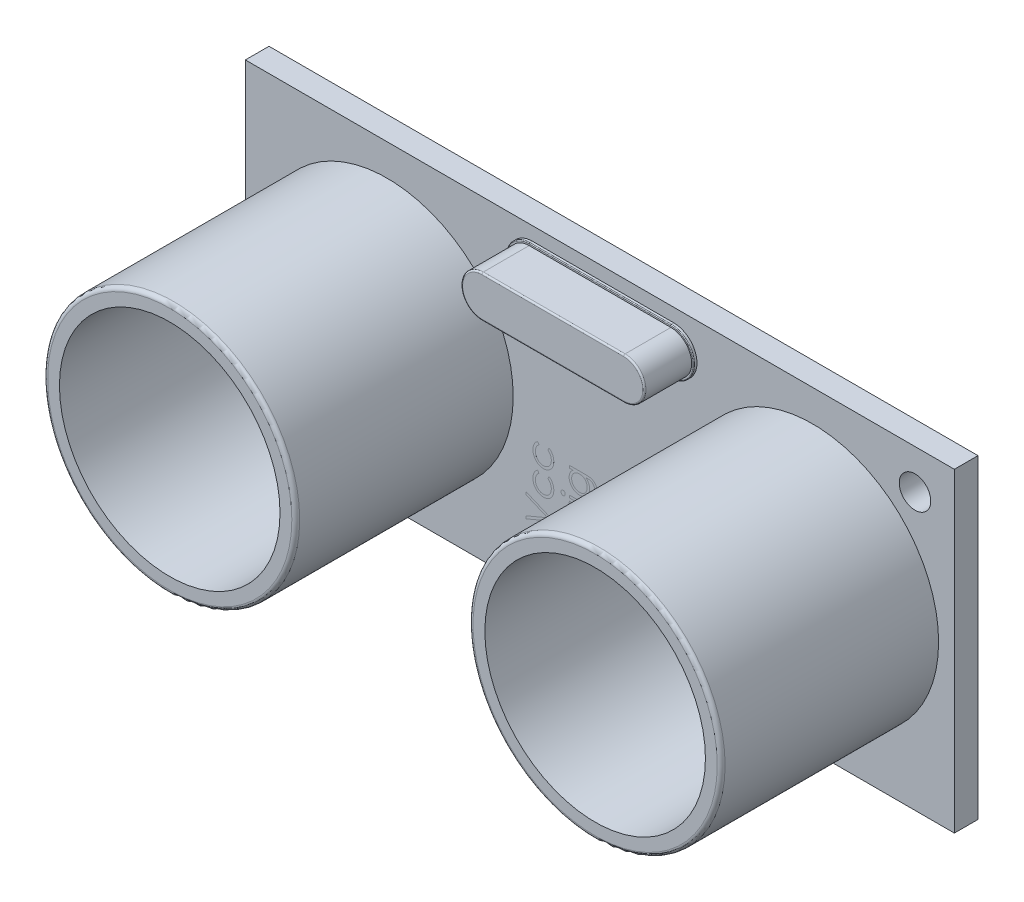
from build123d import *

# Parameters (mm, degrees)
SKETCH1_W                = 45
SKETCH1_H                = 20
SKETCH1_R                = 1
BOSS_EXTRUDE1_DEPTH      = 1.5
SKETCH2_R                = 8
BOSS_EXTRUDE2_DEPTH      = 13.8
SKETCH3_R                = 7
CUT_EXTRUDE1_DEPTH       = 11
SKETCH4_R                = 6
BOSS_EXTRUDE3_DEPTH      = 1
FILLET1_R                = 0.25
BOSS_EXTRUDE4_DEPTH      = 0.2
BOSS_EXTRUDE5_DEPTH      = 3
FILLET2_R                = 0.1
FILLET3_R                = 0.05
BOSS_EXTRUDE6_DEPTH      = 4
BOSS_EXTRUDE6_DEPTH_BACK = 2
SKETCH9_R                = 0.635
SKETCH10_W               = 1.278846153
SKETCH10_H               = 0.157051282
BOSS_EXTRUDE7_DEPTH      = 0.0001


with BuildPart() as part:
    # Sketch1 → Boss-Extrude1 (new body)
    with BuildSketch(Plane.XY):
        with Locations((22.5, 10)):
            Rectangle(SKETCH1_W, SKETCH1_H)
        with Locations((2.5, 2.5)):
            Circle(SKETCH1_R, mode=Mode.SUBTRACT)
        with Locations((42.5, 17.5)):
            Circle(SKETCH1_R, mode=Mode.SUBTRACT)
    extrude(amount=BOSS_EXTRUDE1_DEPTH)

    # Sketch2 → Boss-Extrude2 (add)
    with BuildSketch(Plane.XY.offset(1.5)):
        with Locations(Location((9, 10, 0), (0, 0, 180))):
            Circle(SKETCH2_R)
        with Locations(Location((36, 10, 0), (0, 0, 180))):
            Circle(SKETCH2_R)
    extrude(amount=BOSS_EXTRUDE2_DEPTH)

    # Sketch3 → Cut-Extrude1 (cut)
    with BuildSketch(Plane.XY.offset(15.3)):
        with Locations((9, 10)):
            Circle(SKETCH3_R)
        with Locations((36, 10)):
            Circle(SKETCH3_R)
    extrude(amount=-CUT_EXTRUDE1_DEPTH, mode=Mode.SUBTRACT)

    # Sketch4 → Boss-Extrude3 (add)
    with BuildSketch(Plane.XY.offset(4.3)):
        with Locations((9, 10)):
            Circle(SKETCH4_R)
        with Locations((36, 10)):
            Circle(SKETCH4_R)
    extrude(amount=BOSS_EXTRUDE3_DEPTH)

    # Fillet1
    fillet1_edges = [part.edges().sort_by_distance(p)[0] for p in [
        (17, 10, 15.3),
        (44, 10, 15.3),
    ]]
    fillet(fillet1_edges, radius=FILLET1_R)

    # Sketch6 → Boss-Extrude4 (add)
    with BuildSketch(Plane.XY.offset(1.5)):
        with BuildLine():
            Line((18.212740301, 19.143921077), (27.189190296, 19.143921077))
            ThreePointArc((27.189190296, 19.143921077), (28.662935817, 17.670175555), (27.189190296, 16.196430034))
            Line((27.189190296, 16.196430034), (18.212740301, 16.196430034))
            ThreePointArc((18.212740301, 16.196430034), (16.738994779, 17.670175555), (18.212740301, 19.143921077))
        make_face()
    extrude(amount=BOSS_EXTRUDE4_DEPTH)

    # Sketch7 → Boss-Extrude5 (add)
    with BuildSketch(Plane.XY.offset(1.7)):
        with BuildLine():
            Line((18.210106758, 18.998872551), (27.208079194, 18.998872551))
            ThreePointArc((27.208079194, 18.998872551), (28.527429991, 17.679521754), (27.208079194, 16.360170957))
            Line((27.208079194, 16.360170957), (18.210106758, 16.360170957))
            ThreePointArc((18.210106758, 16.360170957), (16.890755961, 17.679521754), (18.210106758, 18.998872551))
        make_face()
    extrude(amount=BOSS_EXTRUDE5_DEPTH)

    # Fillet2
    fillet2_edges = [part.edges().sort_by_distance(p)[0] for p in [
        (16.890755961, 17.679521754, 4.7),
        (22.709092976, 16.360170957, 4.7),
        (28.527429991, 17.679521754, 4.7),
        (22.709092976, 18.998872551, 4.7),
    ]]
    fillet(fillet2_edges, radius=FILLET2_R)

    # Fillet3
    fillet3_edges = [part.edges().sort_by_distance(p)[0] for p in [
        (16.738994779, 17.670175555, 1.7),
        (22.700965298, 16.196430034, 1.7),
        (28.662935817, 17.670175555, 1.7),
        (22.700965298, 19.143921077, 1.7),
    ]]
    fillet(fillet3_edges, radius=FILLET3_R)

    # Sketch9 → Boss-Extrude6 (add, two sides: drawn at the far end of the back side and taken through both)
    with BuildSketch(Plane(origin=(0, 0, 0), x_dir=(-1, 0, 0), z_dir=(0, 0, -1)).offset(-BOSS_EXTRUDE6_DEPTH_BACK)):
        with Locations((-26.31, 2.5)):
            Circle(SKETCH9_R)
        with Locations((-23.77, 2.5)):
            Circle(SKETCH9_R)
        with Locations((-21.23, 2.5)):
            Circle(SKETCH9_R)
        with Locations((-18.69, 2.5)):
            Circle(SKETCH9_R)
    extrude(amount=BOSS_EXTRUDE6_DEPTH + BOSS_EXTRUDE6_DEPTH_BACK)

    # Sketch10 → Boss-Extrude7 (add)
    # profile 1 of 15: a face of its own
    with BuildSketch(Plane.XY.offset(1.5)):
        Polygon((17.803362212, 3.675659669), (17.803362212, 3.8439289), (19.182468783, 4.427262233), (17.803362212, 5.010595566), (17.803362212, 5.178864797), (19.553362212, 4.438480182), (19.553362212, 4.416044284), align=None)
    # profile 2 of 15: a face of its own
    with BuildSketch(Plane.XY.offset(1.5)):
        with BuildLine():
            Line((18.551809728, 6.72694172), (18.633490417, 6.595481384))
            add(Edge.make_bspline(
                [(18.633490417, 6.595481384), (18.61557622, 6.581066451), (18.580315165, 6.552693103), (18.534810198, 6.503423485), (18.495726678, 6.450917778), (18.463874802, 6.394278754), (18.439264077, 6.333585854), (18.421848974, 6.269078428), (18.410996853, 6.200765676), (18.409763434, 6.153933077), (18.409131443, 6.129936512)],
                knots=[0, 0, 0, 0, 1.026593902, 2.0206758, 2.988051866, 3.946915611, 4.916868779, 5.907761954, 6.927957743, 8, 8, 8, 8], degree=3))
            add(Edge.make_bspline(
                [(18.409131443, 6.129936512), (18.409659864, 6.110757033), (18.410700575, 6.072983572), (18.417205822, 6.017530495), (18.429026826, 5.964709319), (18.444602304, 5.914188964), (18.465477449, 5.866328755), (18.490882327, 5.821003296), (18.520407347, 5.777810551), (18.55461262, 5.73800218), (18.591811954, 5.701587677), (18.631688801, 5.67003822), (18.673048747, 5.642569753), (18.716924618, 5.621016775), (18.762312645, 5.60337919), (18.810069573, 5.591775829), (18.859583576, 5.584043482), (18.893342746, 5.583158817), (18.910433526, 5.582710951)],
                knots=[0, 0, 0, 0, 1.112346261, 2.190735716, 3.231507886, 4.247384806, 5.251966152, 6.253067467, 7.256802811, 8.280671706, 9.291813951, 10.270744147, 11.225547591, 12.165006084, 13.100104208, 14.043489273, 15.009504848, 16, 16, 16, 16], degree=3))
            add(Edge.make_bspline(
                [(18.910433526, 5.582710951), (18.932814933, 5.58361406), (18.977390707, 5.585412731), (19.043078589, 5.599093018), (19.106470777, 5.621983742), (19.16722456, 5.652908049), (19.223516747, 5.692161356), (19.274009771, 5.738243731), (19.317717438, 5.791204317), (19.353953796, 5.850570195), (19.383084454, 5.914949146), (19.403838127, 5.983644176), (19.416364312, 6.056094073), (19.417942284, 6.105697445), (19.418746827, 6.130988194)],
                knots=[0, 0, 0, 0, 0.96628757, 1.924499989, 2.884001032, 3.87047137, 4.860396324, 5.839257425, 6.814467993, 7.816059692, 8.834901047, 9.858382822, 10.908076205, 12, 12, 12, 12], degree=3))
            add(Edge.make_bspline(
                [(19.418746827, 6.130988194), (19.418097079, 6.154165787), (19.41682015, 6.199715906), (19.406055669, 6.266299548), (19.388433852, 6.329689504), (19.363860027, 6.389883519), (19.332096269, 6.446771602), (19.292916684, 6.49998619), (19.247448383, 6.550586159), (19.212289398, 6.580334647), (19.194387853, 6.595481384)],
                knots=[0, 0, 0, 0, 1.039848629, 2.043578496, 3.018386758, 3.987534228, 4.954977003, 5.934852016, 6.948509513, 8, 8, 8, 8], degree=3))
            Line((19.194387853, 6.595481384), (19.280625834, 6.72694172))
            add(Edge.make_bspline(
                [(19.280625834, 6.72694172), (19.292071197, 6.719147869), (19.314923936, 6.703586036), (19.347145994, 6.677572223), (19.377306835, 6.649512307), (19.40536603, 6.619515759), (19.43199504, 6.587974254), (19.455920827, 6.553810299), (19.478488238, 6.518125493), (19.498794674, 6.480500914), (19.517047835, 6.441325565), (19.532743421, 6.40065457), (19.546228474, 6.358664664), (19.556947147, 6.315306476), (19.565502566, 6.270494527), (19.571179417, 6.22434471), (19.575417058, 6.176872919), (19.575669991, 6.144786843), (19.575798109, 6.128534268)],
                knots=[0, 0, 0, 0, 0.954134338, 1.905101784, 2.851144739, 3.791306361, 4.734911809, 5.6936923, 6.663572882, 7.643865596, 8.638447847, 9.640600242, 10.646758161, 11.676244097, 12.717260333, 13.78922464, 14.880174919, 16, 16, 16, 16], degree=3))
            add(Edge.make_bspline(
                [(19.575798109, 6.128534268), (19.575351729, 6.103729151), (19.574476821, 6.055110941), (19.564883028, 5.983945109), (19.55036629, 5.9159549), (19.529707539, 5.851020833), (19.502425286, 5.789539888), (19.469862946, 5.731000236), (19.430944426, 5.676005965), (19.386594301, 5.624917602), (19.338459422, 5.578197311), (19.286817925, 5.53754331), (19.232810939, 5.503090314), (19.176098043, 5.474709062), (19.116911787, 5.452517571), (19.054890598, 5.43723952), (18.990560693, 5.427381602), (18.946694771, 5.426238958), (18.924455962, 5.425659669)],
                knots=[0, 0, 0, 0, 1.113096611, 2.181677437, 3.217994567, 4.231807234, 5.234933164, 6.233258928, 7.234764453, 8.254006763, 9.267004511, 10.242118657, 11.199842941, 12.138404996, 13.084707599, 14.031460992, 15.002005182, 16, 16, 16, 16], degree=3))
            add(Edge.make_bspline(
                [(18.924455962, 5.425659669), (18.909366745, 5.425880177), (18.879351801, 5.426318804), (18.834804268, 5.431349768), (18.790849995, 5.437849004), (18.748046135, 5.448861873), (18.70574349, 5.461582189), (18.66445194, 5.477819954), (18.623979603, 5.496867652), (18.584430739, 5.518493626), (18.546455969, 5.542837998), (18.510579136, 5.569778615), (18.476369254, 5.598300783), (18.445007373, 5.629738839), (18.415239278, 5.662758666), (18.387860216, 5.698294454), (18.36278972, 5.736142379), (18.339564212, 5.775734041), (18.318884495, 5.817046396), (18.301067876, 5.859829732), (18.285841588, 5.903826246), (18.273787128, 5.949106318), (18.263678417, 5.995369405), (18.257319493, 6.042980074), (18.252826357, 6.091756185), (18.252330961, 6.124784196), (18.252080161, 6.141505021)],
                knots=[0, 0, 0, 0, 0.990994727, 1.971252077, 2.943264845, 3.907940874, 4.872158414, 5.844625996, 6.82015047, 7.809835459, 8.804511986, 9.781214284, 10.756496977, 11.728388426, 12.696359165, 13.676225489, 14.672885716, 15.677705647, 16.690706858, 17.706033469, 18.721040654, 19.747369689, 20.783475414, 21.830280724, 22.901553713, 24, 24, 24, 24], degree=3))
            add(Edge.make_bspline(
                [(18.252080161, 6.141505021), (18.252541059, 6.162445101), (18.25346055, 6.204220593), (18.261200585, 6.26619056), (18.272866128, 6.327249611), (18.290162436, 6.386317767), (18.311058705, 6.442710418), (18.334665582, 6.495358192), (18.361498287, 6.543466003), (18.391392543, 6.587458188), (18.425446871, 6.627322558), (18.463314643, 6.66408085), (18.505268431, 6.697975248), (18.536167928, 6.717206543), (18.551809728, 6.72694172)],
                knots=[0, 0, 0, 0, 1.095139042, 2.184804066, 3.262657822, 4.34424993, 5.400369085, 6.407210964, 7.359649996, 8.278719237, 9.185177137, 10.097389079, 11.036869154, 12, 12, 12, 12], degree=3))
        make_face()
    # profile 3 of 15: a face of its own
    with BuildSketch(Plane.XY.offset(1.5)):
        with BuildLine():
            Line((18.551809728, 8.297454541), (18.633490417, 8.165994204))
            add(Edge.make_bspline(
                [(18.633490417, 8.165994204), (18.61557622, 8.151579271), (18.580315165, 8.123205924), (18.534810198, 8.073936306), (18.495726678, 8.021430599), (18.463874802, 7.964791575), (18.439264077, 7.904098675), (18.421848974, 7.839591249), (18.410996853, 7.771278497), (18.409763434, 7.724445897), (18.409131443, 7.700449332)],
                knots=[0, 0, 0, 0, 1.026593902, 2.0206758, 2.988051866, 3.946915611, 4.916868779, 5.907761954, 6.927957743, 8, 8, 8, 8], degree=3))
            add(Edge.make_bspline(
                [(18.409131443, 7.700449332), (18.409659864, 7.681269854), (18.410700575, 7.643496393), (18.417205822, 7.588043316), (18.429026826, 7.535222139), (18.444602304, 7.484701785), (18.465477449, 7.436841576), (18.490882327, 7.391516116), (18.520407347, 7.348323371), (18.55461262, 7.308515001), (18.591811954, 7.272100497), (18.631688801, 7.24055104), (18.673048747, 7.213082573), (18.716924618, 7.191529595), (18.762312645, 7.17389201), (18.810069573, 7.16228865), (18.859583576, 7.154556302), (18.893342746, 7.153671638), (18.910433526, 7.153223771)],
                knots=[0, 0, 0, 0, 1.112346261, 2.190735716, 3.231507886, 4.247384806, 5.251966152, 6.253067467, 7.256802811, 8.280671706, 9.291813951, 10.270744147, 11.225547591, 12.165006084, 13.100104208, 14.043489273, 15.009504848, 16, 16, 16, 16], degree=3))
            add(Edge.make_bspline(
                [(18.910433526, 7.153223771), (18.932814933, 7.154126881), (18.977390707, 7.155925552), (19.043078589, 7.169605839), (19.106470777, 7.192496563), (19.16722456, 7.22342087), (19.223516747, 7.262674177), (19.274009771, 7.308756551), (19.317717438, 7.361717138), (19.353953796, 7.421083015), (19.383084454, 7.485461966), (19.403838127, 7.554156997), (19.416364312, 7.626606893), (19.417942284, 7.676210266), (19.418746827, 7.701501015)],
                knots=[0, 0, 0, 0, 0.96628757, 1.924499989, 2.884001032, 3.87047137, 4.860396324, 5.839257425, 6.814467993, 7.816059692, 8.834901047, 9.858382822, 10.908076205, 12, 12, 12, 12], degree=3))
            add(Edge.make_bspline(
                [(19.418746827, 7.701501015), (19.418097079, 7.724678607), (19.41682015, 7.770228726), (19.406055669, 7.836812369), (19.388433852, 7.900202324), (19.363860027, 7.96039634), (19.332096269, 8.017284423), (19.292916684, 8.07049901), (19.247448383, 8.121098979), (19.212289398, 8.150847468), (19.194387853, 8.165994204)],
                knots=[0, 0, 0, 0, 1.039848629, 2.043578496, 3.018386758, 3.987534228, 4.954977003, 5.934852016, 6.948509513, 8, 8, 8, 8], degree=3))
            Line((19.194387853, 8.165994204), (19.280625834, 8.297454541))
            add(Edge.make_bspline(
                [(19.280625834, 8.297454541), (19.292071197, 8.28966069), (19.314923936, 8.274098856), (19.347145994, 8.248085043), (19.377306835, 8.220025128), (19.40536603, 8.190028579), (19.43199504, 8.158487074), (19.455920827, 8.124323119), (19.478488238, 8.088638314), (19.498794674, 8.051013735), (19.517047835, 8.011838386), (19.532743421, 7.971167391), (19.546228474, 7.929177485), (19.556947147, 7.885819297), (19.565502566, 7.841007347), (19.571179417, 7.79485753), (19.575417058, 7.747385739), (19.575669991, 7.715299664), (19.575798109, 7.699047089)],
                knots=[0, 0, 0, 0, 0.954134338, 1.905101784, 2.851144739, 3.791306361, 4.734911809, 5.6936923, 6.663572882, 7.643865596, 8.638447847, 9.640600242, 10.646758161, 11.676244097, 12.717260333, 13.78922464, 14.880174919, 16, 16, 16, 16], degree=3))
            add(Edge.make_bspline(
                [(19.575798109, 7.699047089), (19.575351729, 7.674241971), (19.574476821, 7.625623761), (19.564883028, 7.554457929), (19.55036629, 7.486467721), (19.529707539, 7.421533653), (19.502425286, 7.360052708), (19.469862946, 7.301513056), (19.430944426, 7.246518786), (19.386594301, 7.195430423), (19.338459422, 7.148710132), (19.286817925, 7.108056131), (19.232810939, 7.073603135), (19.176098043, 7.045221883), (19.116911787, 7.023030392), (19.054890598, 7.00775234), (18.990560693, 6.997894423), (18.946694771, 6.996751778), (18.924455962, 6.996172489)],
                knots=[0, 0, 0, 0, 1.113096611, 2.181677437, 3.217994567, 4.231807234, 5.234933164, 6.233258928, 7.234764453, 8.254006763, 9.267004511, 10.242118657, 11.199842941, 12.138404996, 13.084707599, 14.031460992, 15.002005182, 16, 16, 16, 16], degree=3))
            add(Edge.make_bspline(
                [(18.924455962, 6.996172489), (18.909366745, 6.996392997), (18.879351801, 6.996831624), (18.834804268, 7.001862588), (18.790849995, 7.008361825), (18.748046135, 7.019374693), (18.70574349, 7.032095009), (18.66445194, 7.048332775), (18.623979603, 7.067380472), (18.584430739, 7.089006446), (18.546455969, 7.113350819), (18.510579136, 7.140291435), (18.476369254, 7.168813603), (18.445007373, 7.200251659), (18.415239278, 7.233271486), (18.387860216, 7.268807274), (18.36278972, 7.3066552), (18.339564212, 7.346246861), (18.318884495, 7.387559217), (18.301067876, 7.430342552), (18.285841588, 7.474339067), (18.273787128, 7.519619139), (18.263678417, 7.565882225), (18.257319493, 7.613492894), (18.252826357, 7.662269006), (18.252330961, 7.695297017), (18.252080161, 7.712017842)],
                knots=[0, 0, 0, 0, 0.990994727, 1.971252077, 2.943264845, 3.907940874, 4.872158414, 5.844625996, 6.82015047, 7.809835459, 8.804511986, 9.781214284, 10.756496977, 11.728388426, 12.696359165, 13.676225489, 14.672885716, 15.677705647, 16.690706858, 17.706033469, 18.721040654, 19.747369689, 20.783475414, 21.830280724, 22.901553713, 24, 24, 24, 24], degree=3))
            add(Edge.make_bspline(
                [(18.252080161, 7.712017842), (18.252541059, 7.732957922), (18.25346055, 7.774733414), (18.261200585, 7.83670338), (18.272866128, 7.897762431), (18.290162436, 7.956830587), (18.311058705, 8.013223238), (18.334665582, 8.065871013), (18.361498287, 8.113978824), (18.391392543, 8.157971009), (18.425446871, 8.197835379), (18.463314643, 8.23459367), (18.505268431, 8.268488068), (18.536167928, 8.287719364), (18.551809728, 8.297454541)],
                knots=[0, 0, 0, 0, 1.095139042, 2.184804066, 3.262657822, 4.34424993, 5.400369085, 6.407210964, 7.359649996, 8.278719237, 9.185177137, 10.097389079, 11.036869154, 12, 12, 12, 12], degree=3))
        make_face()
    # profile 4 of 15: a face of its own
    with BuildSketch(Plane.XY.offset(1.5)):
        with BuildLine():
            Line((20.57270296, 7.84575142), (20.57270296, 8.002802702))
            Line((20.57270296, 8.002802702), (21.587576758, 8.002802702))
            add(Edge.make_bspline(
                [(21.587576758, 8.002802702), (21.609195555, 8.002664181), (21.650925041, 8.002396802), (21.711264181, 8.000471316), (21.766997224, 7.996410977), (21.818378353, 7.991806637), (21.865169408, 7.985183279), (21.907510011, 7.977095095), (21.945440792, 7.967977255), (21.968803212, 7.959967147), (21.979854402, 7.956178103)],
                knots=[0, 0, 0, 0, 1.307562039, 2.523909702, 3.650326591, 4.686913197, 5.643429486, 6.506965704, 7.293745905, 8, 8, 8, 8], degree=3))
            add(Edge.make_bspline(
                [(21.979854402, 7.956178103), (21.994219329, 7.950583457), (22.022519681, 7.93956144), (22.062637325, 7.918919012), (22.100408728, 7.89580062), (22.135634097, 7.869402582), (22.168096727, 7.839812237), (22.198601989, 7.807898565), (22.226002217, 7.772541963), (22.250626505, 7.734361547), (22.27323845, 7.694128194), (22.292529917, 7.651539374), (22.308619821, 7.606823887), (22.321859021, 7.560188059), (22.332539827, 7.511634611), (22.339666213, 7.461001919), (22.34446481, 7.408461093), (22.344911985, 7.372739013), (22.345138857, 7.354615603)],
                knots=[0, 0, 0, 0, 0.98202571, 1.934689484, 2.871054655, 3.802072519, 4.735470746, 5.668036537, 6.612630213, 7.581518814, 8.561763468, 9.551722253, 10.55777311, 11.588015789, 12.63986657, 13.723744117, 14.845153492, 16, 16, 16, 16], degree=3))
            add(Edge.make_bspline(
                [(22.345138857, 7.354615603), (22.34465691, 7.328180633), (22.343715789, 7.276559865), (22.334720042, 7.201144587), (22.320209782, 7.129754574), (22.29953605, 7.062910123), (22.273971098, 7.001283776), (22.24468507, 6.945219694), (22.211087588, 6.89523467), (22.172838012, 6.850172698), (22.127355969, 6.809501941), (22.073756608, 6.771238284), (22.011223145, 6.734407817), (21.965326791, 6.712823497), (21.941292703, 6.701520651)],
                knots=[0, 0, 0, 0, 1.157856589, 2.260999188, 3.322382479, 4.345906448, 5.321474636, 6.242187631, 7.112686896, 7.955149481, 8.825136643, 9.778649332, 10.836767353, 12, 12, 12, 12], degree=3))
            Line((21.941292703, 6.701520651), (21.941292703, 6.858571933))
            add(Edge.make_bspline(
                [(21.941292703, 6.858571933), (21.961339212, 6.871208764), (22.000527669, 6.895912213), (22.051318442, 6.941955177), (22.094326364, 6.992785117), (22.12922236, 7.049480537), (22.156086519, 7.112436857), (22.174746066, 7.182061382), (22.186034985, 7.258544651), (22.187384717, 7.311806157), (22.188087575, 7.339541485)],
                knots=[0, 0, 0, 0, 0.997887113, 1.950746426, 2.877762071, 3.798308985, 4.747694893, 5.754452072, 6.830656281, 8, 8, 8, 8], degree=3))
            add(Edge.make_bspline(
                [(22.188087575, 7.339541485), (22.187375492, 7.366926136), (22.186002668, 7.419721003), (22.174741584, 7.495620455), (22.156080715, 7.565017873), (22.129277157, 7.627146787), (22.097081851, 7.681620679), (22.061474722, 7.728850817), (22.020848153, 7.766802069), (21.983477695, 7.79242582), (21.950162503, 7.808339036), (21.921488057, 7.818482173), (21.889167426, 7.826662495), (21.853123485, 7.833684706), (21.813342401, 7.839249014), (21.769688508, 7.84289976), (21.72245707, 7.845490879), (21.689710765, 7.845662565), (21.672763056, 7.84575142)],
                knots=[0, 0, 0, 0, 1.570880491, 3.028500349, 4.391799536, 5.683507043, 6.897971719, 8.016608159, 9.065046722, 10.074948333, 10.602832593, 11.179761774, 11.817338097, 12.514350094, 13.286299219, 14.121078732, 15.027572402, 16, 16, 16, 16], degree=3))
            Line((21.672763056, 7.84575142), (21.606507046, 7.84575142))
            add(Edge.make_bspline(
                [(21.606507046, 7.84575142), (21.625470248, 7.829805493), (21.663063094, 7.798194123), (21.712411228, 7.743749253), (21.754398696, 7.683906414), (21.789323862, 7.619511506), (21.816994681, 7.55152423), (21.837044604, 7.481146606), (21.849481012, 7.408576213), (21.850854857, 7.35945596), (21.851549113, 7.334633632)],
                knots=[0, 0, 0, 0, 1.012670515, 2.007528466, 2.995541538, 3.996581493, 4.997861088, 5.991949332, 6.98525577, 8, 8, 8, 8], degree=3))
            add(Edge.make_bspline(
                [(21.851549113, 7.334633632), (21.851240681, 7.320021048), (21.850627694, 7.290979683), (21.846898859, 7.247712794), (21.839637559, 7.205279766), (21.83033943, 7.163410297), (21.817875548, 7.122396899), (21.803246936, 7.081748156), (21.785279131, 7.042054383), (21.765049849, 7.003113049), (21.742320844, 6.965840323), (21.717763951, 6.930353395), (21.691431517, 6.896870524), (21.663083917, 6.86570191), (21.632756921, 6.836890672), (21.600775206, 6.810048712), (21.566691818, 6.785620045), (21.531128344, 6.763103349), (21.493847881, 6.743574574), (21.455658834, 6.726432388), (21.416642856, 6.711527685), (21.376669325, 6.699644984), (21.335763441, 6.690569428), (21.293992216, 6.683814314), (21.251227022, 6.679982849), (21.222416348, 6.679385386), (21.207919306, 6.679084754)],
                knots=[0, 0, 0, 0, 1.028710361, 2.044481286, 3.053267669, 4.056977562, 5.061496029, 6.068537106, 7.095799505, 8.125955792, 9.155750787, 10.166547241, 11.162135275, 12.151998358, 13.129411568, 14.10464185, 15.088574784, 16.079052837, 17.065149435, 18.048153627, 19.024354702, 20.002874835, 20.980703288, 21.971932454, 22.97951087, 24, 24, 24, 24], degree=3))
            add(Edge.make_bspline(
                [(21.207919306, 6.679084754), (21.193417758, 6.679344337), (21.164470828, 6.679862498), (21.121531136, 6.684337987), (21.079166418, 6.690722082), (21.037813347, 6.700825967), (20.997000971, 6.712987228), (20.957030743, 6.728049014), (20.917890489, 6.746158394), (20.879551223, 6.766663269), (20.842527415, 6.789705315), (20.807364092, 6.814971555), (20.774320006, 6.842492493), (20.743061796, 6.87188845), (20.713891049, 6.903518359), (20.686878566, 6.937365855), (20.661571553, 6.973097295), (20.638515885, 7.01082342), (20.618124762, 7.049962114), (20.599518463, 7.089519023), (20.584751403, 7.130018141), (20.571739854, 7.170704411), (20.562522256, 7.212294368), (20.555411135, 7.254278065), (20.551078775, 7.296799234), (20.550537982, 7.325275681), (20.550267062, 7.339541485)],
                knots=[0, 0, 0, 0, 1.008818848, 2.013730394, 3.001654427, 3.987803273, 4.973046549, 5.963777569, 6.957074694, 7.972068341, 8.987420212, 9.989399531, 10.982630087, 11.977756091, 12.973280677, 13.973972381, 14.989194003, 16.018387222, 17.047741039, 18.059210846, 19.057554164, 20.045176975, 21.029480261, 22.018708529, 23.007435371, 24, 24, 24, 24], degree=3))
            add(Edge.make_bspline(
                [(20.550267062, 7.339541485), (20.550945399, 7.363066954), (20.552284905, 7.409522528), (20.562795478, 7.477888029), (20.579552485, 7.543859149), (20.6035603, 7.607808157), (20.636335319, 7.670255982), (20.679506793, 7.73099681), (20.733461963, 7.790206377), (20.774838395, 7.826745292), (20.796360812, 7.84575142)],
                knots=[0, 0, 0, 0, 0.96728863, 1.910097829, 2.838038873, 3.762875196, 4.71315279, 5.730631239, 6.819562287, 8, 8, 8, 8], degree=3))
            Line((20.796360812, 7.84575142), (20.57270296, 7.84575142))
        make_face()
        with BuildLine():
            add(Edge.make_bspline(
                [(20.707318344, 7.352161677), (20.708101741, 7.329197785), (20.709652702, 7.28373415), (20.722803331, 7.217068703), (20.743618036, 7.152858408), (20.772589667, 7.091736388), (20.809204665, 7.035110656), (20.852766922, 6.984435203), (20.902678809, 6.940253363), (20.958297343, 6.902869012), (21.018394994, 6.873004562), (21.081713243, 6.852142994), (21.147146027, 6.838353737), (21.191723564, 6.836880053), (21.214229402, 6.836136036)],
                knots=[0, 0, 0, 0, 1.026191648, 2.031641866, 3.026511193, 4.038688626, 5.047555432, 6.033268986, 7.01798463, 8.019529538, 9.022150945, 10.008736843, 10.994672018, 12, 12, 12, 12], degree=3))
            add(Edge.make_bspline(
                [(21.214229402, 6.836136036), (21.231195488, 6.836500372), (21.264562819, 6.837216915), (21.313539604, 6.844057919), (21.360258588, 6.855249872), (21.4046754, 6.870712637), (21.446795701, 6.890471022), (21.486616551, 6.914840735), (21.524160239, 6.943685686), (21.559109959, 6.976609509), (21.590939799, 7.012899148), (21.618908991, 7.052258362), (21.641784306, 7.09463609), (21.661554737, 7.138989467), (21.675994267, 7.186394852), (21.687013658, 7.236169393), (21.693318036, 7.288665242), (21.694099435, 7.324451112), (21.694497831, 7.342696533)],
                knots=[0, 0, 0, 0, 1.039710933, 2.044807362, 3.024849673, 3.981007225, 4.923240656, 5.871799057, 6.837597342, 7.820855272, 8.810901995, 9.792827897, 10.773995565, 11.758948565, 12.765014796, 13.806304263, 14.881544521, 16, 16, 16, 16], degree=3))
            add(Edge.make_bspline(
                [(21.694497831, 7.342696533), (21.694114027, 7.361178412), (21.693363501, 7.39731953), (21.686911752, 7.450104999), (21.676500764, 7.500121369), (21.661719251, 7.54732278), (21.642858376, 7.591887451), (21.618990067, 7.633314758), (21.591807851, 7.672492982), (21.560101844, 7.708171187), (21.525159346, 7.740433269), (21.487136899, 7.768548653), (21.446606639, 7.792505877), (21.403573137, 7.812344712), (21.35770196, 7.827490314), (21.309107782, 7.837649767), (21.258023413, 7.844753139), (21.223019105, 7.845413602), (21.205114819, 7.84575142)],
                knots=[0, 0, 0, 0, 1.121943988, 2.193949579, 3.223793937, 4.220241907, 5.192961521, 6.155822191, 7.11847367, 8.083710714, 9.04790392, 10.001595906, 10.949595423, 11.902125208, 12.873731292, 13.87582262, 14.913508608, 16, 16, 16, 16], degree=3))
            add(Edge.make_bspline(
                [(21.205114819, 7.84575142), (21.181806387, 7.845080435), (21.136269903, 7.843769564), (21.069909566, 7.831437848), (21.007450017, 7.811433721), (20.949051075, 7.783671197), (20.895526158, 7.748721502), (20.848230657, 7.706213699), (20.805860205, 7.658028717), (20.771021731, 7.602988185), (20.74262444, 7.544075719), (20.722011132, 7.482160187), (20.709876348, 7.417840544), (20.70817592, 7.374180634), (20.707318344, 7.352161677)],
                knots=[0, 0, 0, 0, 1.070678282, 2.091729125, 3.090678259, 4.078281522, 5.055707048, 6.018451281, 6.993304669, 7.996175111, 9.002951586, 9.993356152, 10.987991402, 12, 12, 12, 12], degree=3))
        make_face(mode=Mode.SUBTRACT)
    # profile 5 of 15: a face of its own
    with BuildSketch(Plane.XY.offset(1.5)):
        with BuildLine():
            add(Edge.make_bspline(
                [(20.034241421, 6.285755427), (20.034693497, 6.295501085), (20.035578749, 6.314584955), (20.043159488, 6.342181588), (20.056009331, 6.367310095), (20.073249171, 6.389598961), (20.093523893, 6.408724904), (20.117154377, 6.422115259), (20.142683696, 6.430721458), (20.160491241, 6.431760735), (20.169557928, 6.432289882)],
                knots=[0, 0, 0, 0, 1.055194115, 2.066272739, 3.074728998, 4.095836921, 5.109056067, 6.073838105, 7.019297344, 8, 8, 8, 8], degree=3))
            add(Edge.make_bspline(
                [(20.169557928, 6.432289882), (20.178389254, 6.431748802), (20.195847742, 6.430679151), (20.220934478, 6.422121907), (20.244236619, 6.408610788), (20.264471975, 6.389611225), (20.281702285, 6.367306845), (20.294554654, 6.342182452), (20.302134723, 6.314584728), (20.303020067, 6.295501008), (20.30347219, 6.285755427)],
                knots=[0, 0, 0, 0, 0.96129708, 1.900370562, 2.859976407, 3.87933698, 4.906634145, 5.921202961, 6.938410037, 8, 8, 8, 8], degree=3))
            add(Edge.make_bspline(
                [(20.30347219, 6.285755427), (20.30303733, 6.276121289), (20.302190932, 6.257369699), (20.294405923, 6.230186278), (20.281697886, 6.205272033), (20.264584794, 6.182939697), (20.244112345, 6.1643246), (20.220948698, 6.150775438), (20.195844121, 6.142237957), (20.178388038, 6.141165642), (20.169557928, 6.140623215)],
                knots=[0, 0, 0, 0, 1.054934014, 2.053291228, 3.073705704, 4.106921865, 5.123545215, 6.088680038, 7.033164197, 8, 8, 8, 8], degree=3))
            add(Edge.make_bspline(
                [(20.169557928, 6.140623215), (20.160492503, 6.141153759), (20.142687436, 6.142195779), (20.11713992, 6.150781837), (20.093649169, 6.164211741), (20.073136419, 6.182952023), (20.056013702, 6.205268753), (20.043308211, 6.230187126), (20.035522542, 6.257369475), (20.034676234, 6.276121213), (20.034241421, 6.285755427)],
                knots=[0, 0, 0, 0, 0.98631895, 1.937192651, 2.907499808, 3.917963147, 4.944918757, 5.95915025, 6.951458133, 8, 8, 8, 8], degree=3))
        make_face()
    # profile 6 of 15: a face of its own
    with BuildSketch(Plane.XY.offset(1.5)):
        with Locations((21.212126037, 6.286456549)):
            Rectangle(SKETCH10_W, SKETCH10_H)
    # profile 7 of 15: a face of its own
    with BuildSketch(Plane.XY.offset(1.5)):
        with BuildLine():
            Line((20.57270296, 5.445110395), (20.57270296, 5.602161677))
            Line((20.57270296, 5.602161677), (20.760954162, 5.602161677))
            add(Edge.make_bspline(
                [(20.760954162, 5.602161677), (20.743418401, 5.613748638), (20.709881394, 5.63590861), (20.665586085, 5.672913519), (20.628492507, 5.710413306), (20.599308043, 5.749392647), (20.577251714, 5.789469379), (20.561753423, 5.830305558), (20.552142461, 5.872001041), (20.550893033, 5.900088772), (20.550267062, 5.914160876)],
                knots=[0, 0, 0, 0, 1.280091057, 2.448164201, 3.510831157, 4.48793739, 5.405868014, 6.289422536, 7.142991551, 8, 8, 8, 8], degree=3))
            add(Edge.make_bspline(
                [(20.550267062, 5.914160876), (20.550862325, 5.925074039), (20.552087118, 5.947528581), (20.560692531, 5.981519876), (20.574431542, 6.016541602), (20.587351653, 6.039112796), (20.594087174, 6.050879626)],
                knots=[0, 0, 0, 0, 0.901110191, 1.854092781, 2.881294221, 4, 4, 4, 4], degree=3))
            Line((20.594087174, 6.050879626), (20.730104803, 5.964641645))
            add(Edge.make_bspline(
                [(20.730104803, 5.964641645), (20.72673467, 5.957087134), (20.720337512, 5.942747227), (20.712766507, 5.921769944), (20.708308549, 5.902429275), (20.70763319, 5.890107496), (20.707318344, 5.884363199)],
                knots=[0, 0, 0, 0, 1.180555205, 2.24091978, 3.179933427, 4, 4, 4, 4], degree=3))
            add(Edge.make_bspline(
                [(20.707318344, 5.884363199), (20.708151785, 5.871756549), (20.709851761, 5.846042636), (20.723407094, 5.808416969), (20.744678503, 5.771579281), (20.768900349, 5.742605164), (20.792167551, 5.720091732), (20.812531483, 5.703900643), (20.835576885, 5.6893689), (20.860413001, 5.675272722), (20.887663147, 5.66217631), (20.917371778, 5.650472741), (20.949293571, 5.639527651), (20.971489538, 5.633363881), (20.98285921, 5.630206549)],
                knots=[0, 0, 0, 0, 1.125322384, 2.295331465, 3.535939348, 4.916963136, 5.656144286, 6.429838446, 7.238666481, 8.090384391, 8.983239461, 9.940052224, 10.944811494, 12, 12, 12, 12], degree=3))
            add(Edge.make_bspline(
                [(20.98285921, 5.630206549), (20.992997235, 5.627836263), (21.015564797, 5.622559932), (21.053253496, 5.617566736), (21.09775281, 5.612434544), (21.149114432, 5.608929773), (21.207535798, 5.605619051), (21.272764878, 5.603790071), (21.344980954, 5.602219869), (21.395351384, 5.602181693), (21.421761453, 5.602161677)],
                knots=[0, 0, 0, 0, 0.566841273, 1.261806378, 2.068780918, 3.007109044, 4.065315289, 5.256255371, 6.561408263, 8, 8, 8, 8], degree=3))
            Line((21.421761453, 5.602161677), (21.851549113, 5.602161677))
            Line((21.851549113, 5.602161677), (21.851549113, 5.445110395))
            Line((21.851549113, 5.445110395), (20.57270296, 5.445110395))
        make_face()
    # profile 8 of 15: a face of its own
    with BuildSketch(Plane.XY.offset(1.5)):
        Polygon((20.281036293, 4.300879626), (20.101549113, 4.300879626), (20.101549113, 5.22075142), (20.281036293, 5.22075142), (20.281036293, 4.839341164), (21.851549113, 4.839341164), (21.851549113, 4.682289882), (20.281036293, 4.682289882), align=None)
    # profile 9 of 15: a face of its own
    with BuildSketch(Plane.XY.offset(1.5)):
        with BuildLine():
            add(Edge.make_bspline(
                [(23.193181999, 7.565653263), (23.193704181, 7.584750071), (23.194733908, 7.622408425), (23.205438499, 7.677482811), (23.22193742, 7.730085266), (23.244706536, 7.780416074), (23.275171531, 7.827575277), (23.3113342, 7.872704757), (23.354477306, 7.91510776), (23.387109367, 7.940157554), (23.403869098, 7.953023055)],
                knots=[0, 0, 0, 0, 0.997600737, 1.967239891, 2.921995117, 3.876339565, 4.846055743, 5.850055787, 6.895794904, 8, 8, 8, 8], degree=3))
            add(Edge.make_bspline(
                [(23.403869098, 7.953023055), (23.420041746, 7.964188962), (23.452364412, 7.986505152), (23.50410136, 8.014556224), (23.557594266, 8.039127531), (23.613585541, 8.05876207), (23.671809159, 8.073689147), (23.732139049, 8.084565922), (23.794583447, 8.091469408), (23.837027345, 8.092183994), (23.858546582, 8.092546292)],
                knots=[0, 0, 0, 0, 0.974492422, 1.947621278, 2.915467704, 3.892853539, 4.88708504, 5.894700399, 6.932604111, 8, 8, 8, 8], degree=3))
            add(Edge.make_bspline(
                [(23.858546582, 8.092546292), (23.880179302, 8.092021842), (23.92284567, 8.090987467), (23.985835599, 8.084376517), (24.046752133, 8.072669113), (24.105647108, 8.056652946), (24.162561377, 8.035845607), (24.217107328, 8.010193183), (24.269830451, 7.980200054), (24.319701506, 7.945883274), (24.36577335, 7.908198926), (24.406138959, 7.867227539), (24.440521312, 7.823636454), (24.468291842, 7.77698321), (24.490317434, 7.727991254), (24.505799414, 7.676267276), (24.515086201, 7.621844628), (24.51628773, 7.584620262), (24.516899948, 7.565653263)],
                knots=[0, 0, 0, 0, 1.107894965, 2.185109244, 3.239066719, 4.281441704, 5.307577007, 6.338291467, 7.364845487, 8.410599108, 9.435040353, 10.408337498, 11.35046711, 12.27106388, 13.181883432, 14.094411748, 15.029042138, 16, 16, 16, 16], degree=3))
            add(Edge.make_bspline(
                [(24.516899948, 7.565653263), (24.516291333, 7.546685175), (24.515096875, 7.509458672), (24.505739984, 7.454940824), (24.490395236, 7.403056912), (24.468279289, 7.353979369), (24.440539924, 7.307302887), (24.406022956, 7.263724921), (24.365904161, 7.22239507), (24.319683026, 7.184740136), (24.269835343, 7.150400584), (24.217106021, 7.120413495), (24.162561726, 7.094759458), (24.105647013, 7.073952551), (24.046752159, 7.057936267), (23.985835592, 7.046228894), (23.922845672, 7.039617937), (23.880179302, 7.038583562), (23.858546582, 7.038059113)],
                knots=[0, 0, 0, 0, 0.97035087, 1.904396978, 2.822082662, 3.732332818, 4.652354079, 5.593894721, 6.570857939, 7.594658757, 8.639758628, 9.6656709, 10.695741012, 11.721234828, 12.762958176, 13.816256772, 14.892797633, 16, 16, 16, 16], degree=3))
            add(Edge.make_bspline(
                [(23.858546582, 7.038059113), (23.837142943, 7.038419827), (23.794813443, 7.039133203), (23.73250604, 7.046100112), (23.672293897, 7.056663327), (23.614566631, 7.072520715), (23.558489248, 7.091433959), (23.504951817, 7.115897193), (23.453360037, 7.144207205), (23.421102833, 7.16643275), (23.404920781, 7.17758235)],
                knots=[0, 0, 0, 0, 1.063892623, 2.1040368, 3.113827242, 4.100449227, 5.078030009, 6.053259504, 7.023403995, 8, 8, 8, 8], degree=3))
            add(Edge.make_bspline(
                [(23.404920781, 7.17758235), (23.38801992, 7.190422493), (23.355181994, 7.215370553), (23.312098455, 7.25804371), (23.275337445, 7.302933769), (23.24526099, 7.350595476), (23.221827512, 7.400761853), (23.205472212, 7.453489914), (23.194702785, 7.508658343), (23.193694728, 7.546437578), (23.193181999, 7.565653263)],
                knots=[0, 0, 0, 0, 1.105877608, 2.148691041, 3.153713737, 4.125868282, 5.080095171, 6.03217926, 6.999105637, 8, 8, 8, 8], degree=3))
        make_face()
        with BuildLine():
            add(Edge.make_bspline(
                [(23.350233281, 7.565302702), (23.350716884, 7.552066116), (23.351673852, 7.525873177), (23.358958637, 7.487375081), (23.37048033, 7.450371551), (23.38689368, 7.414808049), (23.408107934, 7.380789595), (23.43378656, 7.348049792), (23.464429059, 7.317025521), (23.499000431, 7.287656572), (23.537024717, 7.260800679), (23.577435985, 7.237363344), (23.619637446, 7.217068445), (23.664065356, 7.201274009), (23.71005711, 7.187806043), (23.758301306, 7.179589163), (23.808260978, 7.173488968), (23.842283719, 7.172949194), (23.859598265, 7.172674497)],
                knots=[0, 0, 0, 0, 0.892062397, 1.765238749, 2.632457948, 3.499748733, 4.398432829, 5.329985934, 6.299486433, 7.333591616, 8.385110458, 9.433791507, 10.480546765, 11.537424675, 12.60998767, 13.707271034, 14.833205124, 16, 16, 16, 16], degree=3))
            add(Edge.make_bspline(
                [(23.859598265, 7.172674497), (23.881962743, 7.173191279), (23.926229381, 7.17421416), (23.991205766, 7.185074632), (24.054147876, 7.200800443), (24.113661668, 7.223994466), (24.168816506, 7.252494447), (24.218475737, 7.285639203), (24.26080712, 7.32429381), (24.296620112, 7.366789517), (24.324628682, 7.412996667), (24.344897266, 7.46178497), (24.357865673, 7.51274733), (24.359184414, 7.547698004), (24.359848665, 7.565302702)],
                knots=[0, 0, 0, 0, 1.139368929, 2.255184748, 3.350673064, 4.442866719, 5.503577089, 6.511720108, 7.47770502, 8.416871705, 9.336594054, 10.220769263, 11.103799257, 12, 12, 12, 12], degree=3))
            add(Edge.make_bspline(
                [(24.359848665, 7.565302702), (24.359186184, 7.582908597), (24.357870956, 7.617861647), (24.344876482, 7.668806383), (24.324746312, 7.71756987), (24.296373047, 7.763514583), (24.261065584, 7.806321517), (24.218324305, 7.844572808), (24.16883946, 7.877778119), (24.113662766, 7.906284376), (24.054090728, 7.929346758), (23.991266068, 7.945646357), (23.926221359, 7.956360168), (23.881960051, 7.957403695), (23.859598265, 7.957930908)],
                knots=[0, 0, 0, 0, 0.896424748, 1.779675456, 2.664071664, 3.578931997, 4.522916774, 5.48514584, 6.493540845, 7.554516339, 8.646982988, 9.744251569, 10.860346286, 12, 12, 12, 12], degree=3))
            add(Edge.make_bspline(
                [(23.859598265, 7.957930908), (23.842286921, 7.957641224), (23.808270472, 7.957072002), (23.758243994, 7.951182442), (23.710176245, 7.942187006), (23.663917369, 7.929570992), (23.619721474, 7.913058068), (23.577437874, 7.892909896), (23.536910858, 7.869492395), (23.499110115, 7.842210172), (23.464420332, 7.812895655), (23.433769547, 7.781861385), (23.408241121, 7.749152101), (23.386681765, 7.715325963), (23.370658851, 7.679692732), (23.358878492, 7.642791568), (23.351711781, 7.60449122), (23.350728171, 7.578420047), (23.350233281, 7.565302702)],
                knots=[0, 0, 0, 0, 1.167399275, 2.293916598, 3.393210906, 4.464213596, 5.524368342, 6.571665819, 7.620890084, 8.677521736, 9.712162585, 10.682165285, 11.614200933, 12.506655785, 13.381563964, 14.241714977, 15.115343634, 16, 16, 16, 16], degree=3))
        make_face(mode=Mode.SUBTRACT)
    # profile 10 of 15: a face of its own
    with BuildSketch(Plane.XY.offset(1.5)):
        with BuildLine():
            Line((22.699592255, 6.075559113), (22.699592255, 6.210174497))
            Line((22.699592255, 6.210174497), (23.457154355, 6.210174497))
            add(Edge.make_bspline(
                [(23.457154355, 6.210174497), (23.436227615, 6.222294952), (23.396116004, 6.245526997), (23.342178635, 6.285090189), (23.296135943, 6.325993379), (23.258342015, 6.369009832), (23.22912084, 6.414226862), (23.208486238, 6.461575431), (23.195673986, 6.510751336), (23.194012978, 6.544301361), (23.193181999, 6.561085956)],
                knots=[0, 0, 0, 0, 1.256450509, 2.408318517, 3.470791238, 4.452588315, 5.376044572, 6.257483332, 7.128243973, 8, 8, 8, 8], degree=3))
            add(Edge.make_bspline(
                [(23.193181999, 6.561085956), (23.194024282, 6.578127705), (23.195690691, 6.611843797), (23.210081544, 6.66059004), (23.232906245, 6.706337737), (23.264780757, 6.74834198), (23.304302189, 6.786046065), (23.350009354, 6.819308379), (23.402479171, 6.846171236), (23.450471879, 6.864644249), (23.4934777, 6.87656556), (23.530462854, 6.884508376), (23.571766349, 6.891161371), (23.617408289, 6.896241322), (23.667328075, 6.900366678), (23.721557691, 6.903598635), (23.780011121, 6.90521162), (23.820451516, 6.905525148), (23.841369098, 6.905687318)],
                knots=[0, 0, 0, 0, 0.996285565, 1.971092021, 2.950451992, 3.976974868, 5.041747374, 6.139609738, 7.275257294, 8.483941667, 9.144789992, 9.887079528, 10.698256355, 11.59381218, 12.575870282, 13.631565315, 14.774939573, 16, 16, 16, 16], degree=3))
            Line((23.841369098, 6.905687318), (24.49446405, 6.905687318))
            Line((24.49446405, 6.905687318), (24.49446405, 6.771071933))
            Line((24.49446405, 6.771071933), (23.89290155, 6.771071933))
            add(Edge.make_bspline(
                [(23.89290155, 6.771071933), (23.875490622, 6.770938213), (23.842187769, 6.770682438), (23.794504048, 6.770581294), (23.751385108, 6.769418385), (23.712701017, 6.768076862), (23.678576188, 6.766331812), (23.648859895, 6.76440267), (23.62386388, 6.761571316), (23.608709503, 6.759415375), (23.601936005, 6.758451741)],
                knots=[0, 0, 0, 0, 1.43367231, 2.74226502, 3.926091632, 4.985183127, 5.929340614, 6.739626384, 7.436655246, 8, 8, 8, 8], degree=3))
            add(Edge.make_bspline(
                [(23.601936005, 6.758451741), (23.58218297, 6.754608763), (23.544818118, 6.747339385), (23.493346192, 6.729598725), (23.449263331, 6.707873084), (23.413156682, 6.680872691), (23.384474726, 6.649605134), (23.364555679, 6.613154092), (23.352144549, 6.57239951), (23.350883247, 6.543649577), (23.350233281, 6.528834353)],
                knots=[0, 0, 0, 0, 1.286084608, 2.432758329, 3.472581308, 4.417561404, 5.301671356, 6.1650556, 7.054428626, 8, 8, 8, 8], degree=3))
            add(Edge.make_bspline(
                [(23.350233281, 6.528834353), (23.35047266, 6.520050106), (23.350948363, 6.502593666), (23.355708043, 6.476802711), (23.363436754, 6.451722418), (23.374454153, 6.427450696), (23.388362564, 6.403853397), (23.404685477, 6.380468224), (23.425005875, 6.358561682), (23.455480114, 6.329936533), (23.498658886, 6.297638586), (23.55679818, 6.266511003), (23.620427743, 6.241709496), (23.665678298, 6.231985987), (23.688875108, 6.22700142)],
                knots=[0, 0, 0, 0, 0.644873554, 1.28152083, 1.91972944, 2.569216412, 3.234847739, 3.93053473, 4.660000565, 5.425369442, 7.001780425, 8.603889908, 10.259050789, 12, 12, 12, 12], degree=3))
            add(Edge.make_bspline(
                [(23.688875108, 6.22700142), (23.697397303, 6.225659096), (23.716028834, 6.222724457), (23.746545754, 6.219276469), (23.782103222, 6.216645821), (23.822530599, 6.214104534), (23.868005423, 6.212538661), (23.918249572, 6.211017421), (23.973529566, 6.210462732), (24.011975466, 6.21027345), (24.032074226, 6.210174497)],
                knots=[0, 0, 0, 0, 0.601974854, 1.316059127, 2.1422104, 3.089815509, 4.142494093, 5.317148409, 6.597457965, 8, 8, 8, 8], degree=3))
            Line((24.032074226, 6.210174497), (24.49446405, 6.210174497))
            Line((24.49446405, 6.210174497), (24.49446405, 6.075559113))
            Line((24.49446405, 6.075559113), (22.699592255, 6.075559113))
        make_face()
    # profile 11 of 15: a face of its own
    with BuildSketch(Plane.XY.offset(1.5)):
        with BuildLine():
            Line((23.492911566, 5.92075142), (23.574592255, 5.818387638))
            add(Edge.make_bspline(
                [(23.574592255, 5.818387638), (23.556806292, 5.807073181), (23.522346119, 5.785151503), (23.476216439, 5.746999027), (23.437574619, 5.70546688), (23.405271425, 5.661213078), (23.380655753, 5.613504533), (23.362968179, 5.56278206), (23.35213563, 5.50895001), (23.350875866, 5.471967415), (23.350233281, 5.453103183)],
                knots=[0, 0, 0, 0, 1.12284337, 2.175500681, 3.180265739, 4.139623535, 5.086772676, 6.030310645, 6.995292857, 8, 8, 8, 8], degree=3))
            add(Edge.make_bspline(
                [(23.350233281, 5.453103183), (23.350759187, 5.438008596), (23.351795765, 5.408256705), (23.358373125, 5.364542004), (23.370169329, 5.323017494), (23.385938165, 5.283240612), (23.406773529, 5.245623298), (23.432351186, 5.210135358), (23.461850122, 5.176103654), (23.496186986, 5.145058137), (23.533356398, 5.116377565), (23.573097512, 5.091497466), (23.614696021, 5.070252877), (23.658282343, 5.053129894), (23.703784565, 5.03966066), (23.751336648, 5.030429478), (23.800767084, 5.024090482), (23.83445419, 5.023576261), (23.851535364, 5.023315523)],
                knots=[0, 0, 0, 0, 0.984800101, 1.941070887, 2.875085472, 3.795184957, 4.726614095, 5.672129624, 6.6445194, 7.658794156, 8.686415767, 9.703722399, 10.712827818, 11.729191533, 12.754322074, 13.803792861, 14.886404932, 16, 16, 16, 16], degree=3))
            add(Edge.make_bspline(
                [(23.851535364, 5.023315523), (23.873894937, 5.023982041), (23.918279992, 5.025305117), (23.983678577, 5.03611546), (24.047008349, 5.053807422), (24.107559072, 5.078039599), (24.163848301, 5.108713602), (24.214298366, 5.144810369), (24.25819167, 5.186278516), (24.294491583, 5.2330188), (24.323995673, 5.283568278), (24.344751391, 5.33778487), (24.357441845, 5.39490968), (24.35903896, 5.433990912), (24.359848665, 5.453804305)],
                knots=[0, 0, 0, 0, 1.084786785, 2.153364978, 3.207470413, 4.271221031, 5.311873954, 6.311421235, 7.274248805, 8.231833337, 9.174520824, 10.104583037, 11.039061984, 12, 12, 12, 12], degree=3))
            add(Edge.make_bspline(
                [(24.359848665, 5.453804305), (24.359205504, 5.472086889), (24.357941029, 5.50803099), (24.347003331, 5.560551106), (24.329378692, 5.610467448), (24.30461107, 5.65781246), (24.272579294, 5.702358084), (24.233570534, 5.744183753), (24.187854661, 5.783786572), (24.153300327, 5.80661895), (24.135489691, 5.818387638)],
                knots=[0, 0, 0, 0, 0.977666804, 1.922121929, 2.857776524, 3.803307856, 4.771728806, 5.785246748, 6.858430813, 8, 8, 8, 8], degree=3))
            Line((24.135489691, 5.818387638), (24.221727672, 5.92075142))
            add(Edge.make_bspline(
                [(24.221727672, 5.92075142), (24.244215226, 5.908284825), (24.28834802, 5.883818595), (24.346744037, 5.837022473), (24.397924568, 5.784858095), (24.433696851, 5.736091517), (24.458014628, 5.694572023), (24.47383189, 5.662227821), (24.487194093, 5.628833332), (24.498062689, 5.59437957), (24.5065799, 5.558771669), (24.512266238, 5.522063784), (24.516515872, 5.484401416), (24.516770954, 5.458958321), (24.516899948, 5.446091965)],
                knots=[0, 0, 0, 0, 1.567329121, 3.075950915, 4.549120167, 6.018830458, 6.754204875, 7.484857737, 8.214813678, 8.948108804, 9.688724632, 10.447567985, 11.214948429, 12, 12, 12, 12], degree=3))
            add(Edge.make_bspline(
                [(24.516899948, 5.446091965), (24.516456544, 5.42641853), (24.515585796, 5.387784206), (24.505861065, 5.331199571), (24.491500816, 5.277097221), (24.470451496, 5.225554521), (24.443339755, 5.176840906), (24.410430268, 5.130514084), (24.371552871, 5.086896364), (24.327307542, 5.046265979), (24.278869545, 5.009455929), (24.227565081, 4.976795731), (24.173271235, 4.950106646), (24.116884997, 4.927083944), (24.057516418, 4.910379641), (23.995847605, 4.897437894), (23.931524711, 4.890096141), (23.887777698, 4.889170359), (23.8655578, 4.888700138)],
                knots=[0, 0, 0, 0, 0.987436768, 1.939109881, 2.876257238, 3.795318345, 4.728226445, 5.671422934, 6.644584451, 7.658373109, 8.684647591, 9.697790058, 10.708633505, 11.720346085, 12.753399259, 13.802329042, 14.88376325, 16, 16, 16, 16], degree=3))
            add(Edge.make_bspline(
                [(23.8655578, 4.888700138), (23.835584586, 4.889516952), (23.776352844, 4.891131102), (23.689263711, 4.905771567), (23.605366972, 4.928737956), (23.53867756, 4.955913624), (23.487690916, 4.981234559), (23.451970321, 5.00299841), (23.417835738, 5.0254862), (23.386193545, 5.050229747), (23.356650275, 5.076545964), (23.329238586, 5.104660377), (23.303937248, 5.134531569), (23.280833059, 5.16602318), (23.26012682, 5.198901605), (23.242294555, 5.232932832), (23.227027675, 5.267800579), (23.214891827, 5.303747538), (23.204782949, 5.340546234), (23.198467435, 5.378505015), (23.193927011, 5.417236703), (23.193432119, 5.443390533), (23.193181999, 5.456608792)],
                knots=[0, 0, 0, 0, 1.832988054, 3.622270117, 5.388410994, 7.146542647, 8.019596399, 8.869470614, 9.704442917, 10.519770436, 11.325032381, 12.124014951, 12.920593885, 13.718679943, 14.512300476, 15.295968143, 16.067801222, 16.838938343, 17.616020588, 18.400177486, 19.191442721, 20, 20, 20, 20], degree=3))
            add(Edge.make_bspline(
                [(23.193181999, 5.456608792), (23.19364255, 5.473231348), (23.194561688, 5.506405585), (23.202333586, 5.555558539), (23.214081089, 5.604042429), (23.231325875, 5.650866994), (23.252353837, 5.695521104), (23.276005817, 5.737320123), (23.302828511, 5.775528633), (23.332963456, 5.810357868), (23.366963537, 5.841977557), (23.404648659, 5.871396806), (23.44704451, 5.897644761), (23.477363791, 5.912918846), (23.492911566, 5.92075142)],
                knots=[0, 0, 0, 0, 1.023936369, 2.043506901, 3.060122446, 4.094466656, 5.11258624, 6.099690851, 7.050801012, 7.985101845, 8.932824734, 9.908114271, 10.927277728, 12, 12, 12, 12], degree=3))
        make_face()
    # profile 12 of 15: a face of its own
    with BuildSketch(Plane.XY.offset(1.5)):
        Polygon((22.74446405, 4.060815523), (22.74446405, 4.846071933), (22.92395123, 4.846071933), (22.92395123, 4.195430908), (23.462412768, 4.195430908), (23.462412768, 4.846071933), (23.641899948, 4.846071933), (23.641899948, 4.195430908), (24.314976871, 4.195430908), (24.314976871, 4.846071933), (24.49446405, 4.846071933), (24.49446405, 4.060815523), align=None)
    # profile 13 of 15: a face of its own
    with BuildSketch(Plane.XY.offset(1.5)):
        with BuildLine():
            Line((27.099075872, 6.791264241), (25.349075872, 6.791264241))
            Line((25.349075872, 6.791264241), (25.349075872, 7.106067927))
            add(Edge.make_bspline(
                [(25.349075872, 7.106067927), (25.349296161, 7.133530758), (25.349720926, 7.186484818), (25.35243364, 7.262947464), (25.357236892, 7.333580118), (25.364203369, 7.398241188), (25.372849194, 7.457235748), (25.383502269, 7.510304008), (25.39627628, 7.557689193), (25.407063918, 7.586638134), (25.412176833, 7.600358792)],
                knots=[0, 0, 0, 0, 1.315724667, 2.53699131, 3.664990376, 4.706723947, 5.652070057, 6.520539819, 7.298794104, 8, 8, 8, 8], degree=3))
            add(Edge.make_bspline(
                [(25.412176833, 7.600358792), (25.419921554, 7.618390124), (25.435330295, 7.654264902), (25.463984297, 7.705131419), (25.496624271, 7.753062327), (25.533727781, 7.797647355), (25.574413754, 7.839496078), (25.619303513, 7.878353696), (25.668408634, 7.913969641), (25.72135787, 7.946590253), (25.777674578, 7.975502276), (25.836801476, 8.000884038), (25.898577667, 8.022188145), (25.962979489, 8.03978196), (26.030091613, 8.053383253), (26.099849853, 8.063227612), (26.172220239, 8.068751373), (26.221262445, 8.06965276), (26.246161208, 8.070110395)],
                knots=[0, 0, 0, 0, 0.924820798, 1.840005032, 2.747844558, 3.655834569, 4.571532883, 5.497321658, 6.45177289, 7.428952708, 8.427037136, 9.43417611, 10.46056071, 11.505880215, 12.580036295, 13.687359007, 14.825870488, 16, 16, 16, 16], degree=3))
            add(Edge.make_bspline(
                [(26.246161208, 8.070110395), (26.267789778, 8.069912662), (26.310404454, 8.06952307), (26.373219573, 8.064304047), (26.434042518, 8.056610291), (26.493027909, 8.04638705), (26.549915714, 8.032064296), (26.605031337, 8.015437046), (26.658094096, 7.995423837), (26.708795356, 7.972232879), (26.756922479, 7.94685649), (26.801950649, 7.919394936), (26.843916375, 7.890335401), (26.882458462, 7.859035927), (26.918020953, 7.826180519), (26.949988026, 7.791242939), (26.979022066, 7.754783024), (27.004386032, 7.715713079), (27.027212139, 7.674058483), (27.046390536, 7.628408926), (27.062819269, 7.579074755), (27.076037994, 7.525713539), (27.086614084, 7.468483091), (27.093645649, 7.407221566), (27.098448926, 7.342072047), (27.098862713, 7.297366773), (27.099075872, 7.274337158)],
                knots=[0, 0, 0, 0, 1.170654064, 2.306534625, 3.409812701, 4.48945743, 5.54511039, 6.583735728, 7.604814438, 8.612696514, 9.600361941, 10.548644068, 11.466514559, 12.361669555, 13.234549695, 14.08525392, 14.923111402, 15.754832056, 16.604076571, 17.491259905, 18.431531281, 19.416599826, 20.465119979, 21.580179438, 22.75344602, 24, 24, 24, 24], degree=3))
            Line((27.099075872, 7.274337158), (27.099075872, 6.791264241))
        make_face()
        with BuildLine():
            Line((26.919588692, 6.948315523), (26.919588692, 7.121142045))
            add(Edge.make_bspline(
                [(26.919588692, 7.121142045), (26.919467016, 7.146033474), (26.919233898, 7.19372261), (26.91712275, 7.26233615), (26.91370485, 7.324995982), (26.90893706, 7.381833798), (26.902579288, 7.432681498), (26.895512052, 7.477690092), (26.886684085, 7.516783351), (26.878748969, 7.540347597), (26.875067458, 7.551280267)],
                knots=[0, 0, 0, 0, 1.375935935, 2.63613619, 3.794191116, 4.844531808, 5.788349761, 6.626220458, 7.362632744, 8, 8, 8, 8], degree=3))
            add(Edge.make_bspline(
                [(26.875067458, 7.551280267), (26.869429737, 7.565041961), (26.858242745, 7.592349441), (26.837937355, 7.631513328), (26.813779941, 7.667922799), (26.787248973, 7.702648368), (26.756781037, 7.734522652), (26.723514253, 7.764322615), (26.687075877, 7.791921324), (26.647557537, 7.816884092), (26.605550235, 7.839828416), (26.560853186, 7.859476676), (26.513768798, 7.875793014), (26.464639535, 7.889597509), (26.413174652, 7.899986157), (26.359469883, 7.907737943), (26.303384322, 7.912353865), (26.265216952, 7.912821396), (26.245810647, 7.913059113)],
                knots=[0, 0, 0, 0, 0.921403842, 1.828351594, 2.728188198, 3.626274712, 4.532991144, 5.456129275, 6.391765879, 7.362071445, 8.350369972, 9.355505245, 10.383850908, 11.436290664, 12.51566712, 13.635041465, 14.797530299, 16, 16, 16, 16], degree=3))
            add(Edge.make_bspline(
                [(26.245810647, 7.913059113), (26.225350663, 7.912712342), (26.185189051, 7.912031652), (26.126201402, 7.906984299), (26.069488983, 7.899097385), (26.015070066, 7.887417881), (25.962807671, 7.872779583), (25.912718335, 7.854886781), (25.865048742, 7.833484669), (25.819854499, 7.80893269), (25.777369657, 7.781752044), (25.738369406, 7.751518031), (25.702844871, 7.718689778), (25.670263427, 7.683745704), (25.641972892, 7.645486394), (25.616519075, 7.605244985), (25.594959381, 7.562070949), (25.583464278, 7.53187176), (25.577641577, 7.516574738)],
                knots=[0, 0, 0, 0, 1.181456899, 2.31912264, 3.416650319, 4.486100574, 5.530800009, 6.549007929, 7.554886024, 8.545342906, 9.516858806, 10.464454463, 11.390981978, 12.307973961, 13.219011793, 14.134637004, 15.055123625, 16, 16, 16, 16], degree=3))
            add(Edge.make_bspline(
                [(25.577641577, 7.516574738), (25.573583089, 7.504010437), (25.564956047, 7.47730277), (25.555565408, 7.433472996), (25.547226544, 7.384110086), (25.540225444, 7.329032145), (25.535170133, 7.268321435), (25.531384683, 7.202042728), (25.528824655, 7.130042843), (25.528652521, 7.080128792), (25.528563051, 7.054184914)],
                knots=[0, 0, 0, 0, 0.678535917, 1.442349433, 2.301734165, 3.252693306, 4.296065182, 5.433594972, 6.666057041, 8, 8, 8, 8], degree=3))
            Line((25.528563051, 7.054184914), (25.528563051, 6.948315523))
            Line((25.528563051, 6.948315523), (26.919588692, 6.948315523))
        make_face(mode=Mode.SUBTRACT)
    # profile 14 of 15: a face of its own
    with BuildSketch(Plane.XY.offset(1.5)):
        Polygon((27.099075872, 5.481007831), (25.349075872, 5.481007831), (25.349075872, 5.513960555), (26.659823067, 6.513059113), (25.349075872, 6.513059113), (25.349075872, 6.670110395), (27.099075872, 6.670110395), (27.099075872, 6.634353183), (25.792184846, 5.638059113), (27.099075872, 5.638059113), align=None)
    # profile 15 of 15: a face of its own
    with BuildSketch(Plane.XY.offset(1.5)):
        with BuildLine():
            Line((25.647753756, 5.337418087), (25.775357923, 5.218928504))
            add(Edge.make_bspline(
                [(25.775357923, 5.218928504), (25.752504677, 5.197724325), (25.707654729, 5.156110706), (25.648631976, 5.087700264), (25.598156138, 5.016362683), (25.556826298, 4.94249478), (25.524610068, 4.86767724), (25.501284372, 4.793357169), (25.486313203, 4.719862965), (25.484557681, 4.670952503), (25.483691256, 4.646813119)],
                knots=[0, 0, 0, 0, 1.131228739, 2.220058769, 3.273581581, 4.299287612, 5.287588355, 6.22558546, 7.124251278, 8, 8, 8, 8], degree=3))
            add(Edge.make_bspline(
                [(25.483691256, 4.646813119), (25.483897335, 4.632073874), (25.484309033, 4.602628344), (25.489606458, 4.558854549), (25.497188609, 4.515485359), (25.508080871, 4.47271018), (25.522224656, 4.430452233), (25.539377216, 4.388724947), (25.559865955, 4.347550906), (25.583262053, 4.307227076), (25.60890631, 4.267985302), (25.63755422, 4.231206211), (25.667942898, 4.19627016), (25.701113666, 4.164070997), (25.736217955, 4.133845063), (25.773380914, 4.105750847), (25.812802607, 4.080005628), (25.854412328, 4.057088123), (25.897440061, 4.036553204), (25.941071518, 4.01815359), (25.98567232, 4.003148783), (26.03053709, 3.990414193), (26.076269931, 3.981024806), (26.122355842, 3.973980644), (26.169187985, 3.969626494), (26.200579175, 3.969095395), (26.216363532, 3.968828343)],
                knots=[0, 0, 0, 0, 0.957501516, 1.912861744, 2.861921094, 3.818005674, 4.77875521, 5.756232289, 6.748092773, 7.765563501, 8.785158239, 9.792400006, 10.79343694, 11.79245478, 12.794240627, 13.802913259, 14.818340756, 15.851900309, 16.888052092, 17.916351482, 18.927566041, 19.944809946, 20.94584688, 21.959881492, 22.974172083, 24, 24, 24, 24], degree=3))
            add(Edge.make_bspline(
                [(26.216363532, 3.968828343), (26.232502442, 3.969055799), (26.264728529, 3.969509982), (26.312673863, 3.974480237), (26.3601632, 3.981171892), (26.406821687, 3.991557252), (26.453018632, 4.00443812), (26.498405818, 4.020772899), (26.543533826, 4.039183129), (26.587426193, 4.060994762), (26.630156734, 4.085007558), (26.670734841, 4.111524879), (26.708763439, 4.140528505), (26.744697669, 4.171434337), (26.778332455, 4.204585788), (26.809223291, 4.240307273), (26.838056011, 4.277779504), (26.864351484, 4.317342124), (26.887656159, 4.358689417), (26.9085722, 4.40100924), (26.925646263, 4.444596814), (26.939724069, 4.48911673), (26.951112053, 4.534492932), (26.958510877, 4.580961406), (26.963890285, 4.628224303), (26.96426888, 4.660118531), (26.964460487, 4.676260235)],
                knots=[0, 0, 0, 0, 1.014449157, 2.025646438, 3.028452563, 4.028697927, 5.02894329, 6.042220843, 7.060203241, 8.092066841, 9.121966357, 10.140982496, 11.137387924, 12.127269458, 13.11968409, 14.104013744, 15.094576855, 16.091144833, 17.088227379, 18.077399574, 19.057110775, 20.028492336, 21.012245869, 21.995560226, 22.985550843, 24, 24, 24, 24], degree=3))
            add(Edge.make_bspline(
                [(26.964460487, 4.676260235), (26.963982073, 4.695563833), (26.963039426, 4.733598815), (26.955786241, 4.789536251), (26.944449558, 4.843366611), (26.927800284, 4.894733966), (26.906699172, 4.943874173), (26.880652866, 4.9905659), (26.84989268, 5.0349516), (26.814987829, 5.076894341), (26.776265238, 5.115473187), (26.734721638, 5.150613184), (26.690057458, 5.180990849), (26.64277068, 5.207609459), (26.592561631, 5.229591551), (26.539517247, 5.247463003), (26.48390521, 5.26178461), (26.445464119, 5.267311685), (26.425998949, 5.270110395)],
                knots=[0, 0, 0, 0, 1.051248294, 2.071334444, 3.067648371, 4.043976275, 5.007689162, 5.976517957, 6.951184379, 7.945503518, 8.944741336, 9.925210628, 10.905121855, 11.882611117, 12.877296946, 13.885798095, 14.929445017, 16, 16, 16, 16], degree=3))
            Line((26.425998949, 5.270110395), (26.425998949, 4.776520651))
            Line((26.425998949, 4.776520651), (26.246511769, 4.776520651))
            Line((26.246511769, 4.776520651), (26.246511769, 5.427161677))
            add(Edge.make_bspline(
                [(26.246511769, 5.427161677), (26.279954909, 5.426311936), (26.345348569, 5.424650381), (26.440768646, 5.414894992), (26.53097962, 5.398587736), (26.615680483, 5.375282757), (26.695434934, 5.346381787), (26.769665937, 5.310541402), (26.83851097, 5.268119434), (26.901838693, 5.220010952), (26.958754246, 5.166332549), (27.008586411, 5.107932341), (27.050540877, 5.044815618), (27.084677181, 4.977323937), (27.111594652, 4.905664062), (27.130348108, 4.829543535), (27.141783916, 4.749056855), (27.143215269, 4.693943795), (27.143947667, 4.665743408)],
                knots=[0, 0, 0, 0, 1.210777789, 2.367516602, 3.468589441, 4.525646522, 5.54414491, 6.535575829, 7.504180693, 8.467040959, 9.40969031, 10.331064482, 11.240365786, 12.146591654, 13.063565696, 14.005445851, 14.979421581, 16, 16, 16, 16], degree=3))
            add(Edge.make_bspline(
                [(27.143947667, 4.665743408), (27.143662713, 4.648441255), (27.1430998, 4.614261693), (27.139098189, 4.563722179), (27.132985913, 4.514522487), (27.123658919, 4.466709957), (27.112348761, 4.420136793), (27.097798463, 4.37513447), (27.080886849, 4.331504043), (27.061709936, 4.28900248), (27.039623455, 4.248042891), (27.014824771, 4.208615667), (26.987937942, 4.170253412), (26.957994546, 4.133539993), (26.925735591, 4.097911781), (26.890433501, 4.064062411), (26.853194854, 4.030911279), (26.826478709, 4.010608217), (26.813018179, 4.000378824)],
                knots=[0, 0, 0, 0, 1.073875762, 2.121389401, 3.145205683, 4.149514963, 5.14345099, 6.118334554, 7.082773847, 8.046831216, 9.010670274, 9.968651073, 10.936629604, 11.916492246, 12.907433166, 13.917930903, 14.950980736, 16, 16, 16, 16], degree=3))
            add(Edge.make_bspline(
                [(26.813018179, 4.000378824), (26.79165964, 3.985249531), (26.749150547, 3.955138271), (26.681078984, 3.917378745), (26.611191414, 3.884173457), (26.538248331, 3.858165715), (26.463078132, 3.837217578), (26.385297315, 3.822779725), (26.305181427, 3.81313815), (26.25086415, 3.812234427), (26.22337475, 3.811777061)],
                knots=[0, 0, 0, 0, 0.996546363, 1.983388519, 2.961352749, 3.941584443, 4.929901843, 5.931448132, 6.953127772, 8, 8, 8, 8], degree=3))
            add(Edge.make_bspline(
                [(26.22337475, 3.811777061), (26.202799165, 3.81213938), (26.161940781, 3.812858861), (26.101184122, 3.81784656), (26.041576782, 3.826151889), (25.983122185, 3.838311647), (25.925668976, 3.853158706), (25.869290141, 3.871949404), (25.814055137, 3.893982075), (25.760058285, 3.91919431), (25.708156822, 3.947349087), (25.658916524, 3.978338765), (25.61254913, 4.011560874), (25.569165347, 4.047604029), (25.52864698, 4.086015547), (25.490832008, 4.126921167), (25.456131576, 4.170372405), (25.424624289, 4.216371121), (25.396247316, 4.264193211), (25.371610219, 4.31375029), (25.350918414, 4.364891708), (25.333557484, 4.417390677), (25.320711918, 4.471750432), (25.311349168, 4.527491053), (25.304997994, 4.584734794), (25.304470412, 4.623425228), (25.304204077, 4.642956949)],
                knots=[0, 0, 0, 0, 1.071655434, 2.128061403, 3.173026038, 4.20435934, 5.236285151, 6.262162149, 7.297456996, 8.332161263, 9.364392173, 10.370856396, 11.36071223, 12.333276345, 13.306278402, 14.266807646, 15.232567858, 16.199937798, 17.168628015, 18.126763076, 19.079566992, 20.040019098, 21.004013188, 21.985619845, 22.983099746, 24, 24, 24, 24], degree=3))
            add(Edge.make_bspline(
                [(25.304204077, 4.642956949), (25.304500377, 4.658856293), (25.305091646, 4.690583535), (25.30902021, 4.737749471), (25.315399384, 4.784307555), (25.323975751, 4.830140138), (25.33571017, 4.875147421), (25.34982989, 4.919465338), (25.366106759, 4.963258795), (25.385634373, 5.006249746), (25.407770093, 5.04871709), (25.432677147, 5.090936607), (25.460931667, 5.13271872), (25.492088082, 5.174430507), (25.526519352, 5.215824179), (25.564108408, 5.256728538), (25.604509033, 5.297609603), (25.633153793, 5.323978241), (25.647753756, 5.337418087)],
                knots=[0, 0, 0, 0, 0.953642326, 1.902999293, 2.83675562, 3.771511039, 4.698004985, 5.624578465, 6.56059437, 7.498576395, 8.454739615, 9.432017672, 10.437052158, 11.478597186, 12.553703354, 13.664985171, 14.809864987, 16, 16, 16, 16], degree=3))
        make_face()
    extrude(amount=BOSS_EXTRUDE7_DEPTH)


solid = part.part
